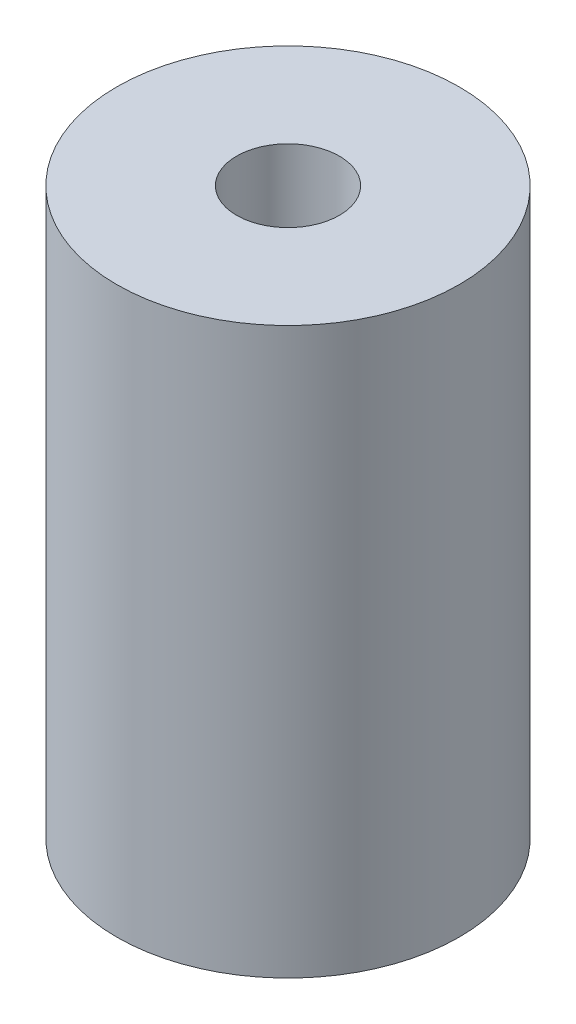
from build123d import *

# Parameters (mm, degrees)
SKETCH_1_R      = 5
SKETCH_1_R_2    = 1.5
EXTRUDE_1_DEPTH = 16.5


with BuildPart() as part:
    # 草图1 → 凸台-拉伸1 (new body)
    with BuildSketch(Plane(origin=(0, 0, 0), x_dir=(1, 0, 0), z_dir=(0, 1, 0))):
        with Locations(Location((0, 0, 0), (0, 0, 270))):
            Circle(SKETCH_1_R)
        with Locations(Location((0, 0, 0), (0, 0, 270))):
            Circle(SKETCH_1_R_2, mode=Mode.SUBTRACT)
    extrude(amount=EXTRUDE_1_DEPTH)


solid = part.part
